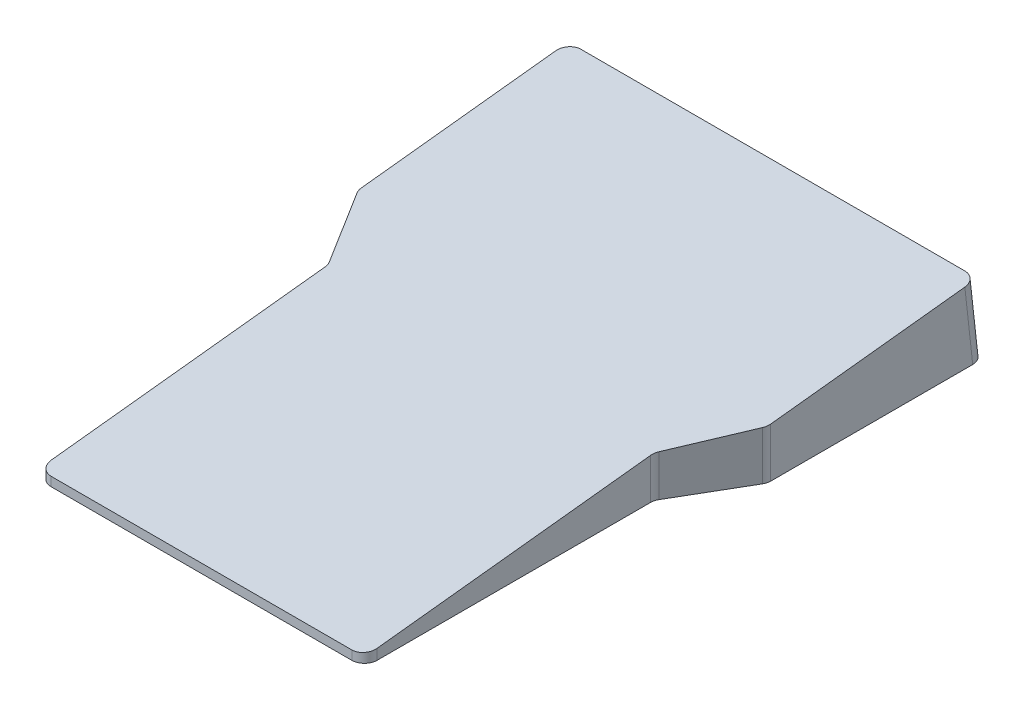
from build123d import *

# Parameters (mm, degrees)
BOSS_EXTRUDE1_DEPTH = 20
SKETCH2_R           = 2.4
SKETCH2_R_2         = 2.35
BOSS_EXTRUDE2_DEPTH = 3
CUT_EXTRUDE1_DEPTH  = 158.718007744
FILLET1_R           = 3.5


with BuildPart() as part:
    # Sketch1 → Boss-Extrude1 (new body)
    with BuildSketch(Plane(origin=(0, 0, 0), x_dir=(1, 0, 0), z_dir=(0, 1, 0))):
        Polygon((-57.597316241, 51.805869074), (-57.597316241, -8.444130926), (-46.097316241, -28.194130926), (-46.097316241, -108.194130926), (43.902683759, -108.194130926), (43.902683759, -28.194130926), (55.402683759, -8.444130926), (55.402683759, 51.805869074), align=None)
    extrude(amount=BOSS_EXTRUDE1_DEPTH)

    # Sketch2 → Boss-Extrude2 (add)
    with BuildSketch(Plane.XZ):
        with Locations(Location((-51.097316241, -45.305869074, 0), (0, 0, 90))):
            Circle(SKETCH2_R)
        with Locations(Location((48.902683759, -45.305869074, 0), (0, 0, 90))):
            Circle(SKETCH2_R)
        with Locations(Location((-31.847316241, -5.130869074, 0), (0, 0, 90))):
            Circle(SKETCH2_R)
        with Locations(Location((-21.847316241, -5.130869074, 0), (0, 0, 90))):
            Circle(SKETCH2_R)
        with Locations(Location((47.402683759, 6.944130926, 0), (0, 0, 90))):
            Circle(SKETCH2_R_2)
        with Locations(Location((-49.597316241, 6.944130926, 0), (0, 0, 90))):
            Circle(SKETCH2_R_2)
    extrude(amount=BOSS_EXTRUDE2_DEPTH)

    # Sketch3 → Cut-Extrude1 (cut, through all)
    with BuildSketch(Plane(origin=(55.402683759, 0, 0), x_dir=(0, 0, -1), z_dir=(1, 0, 0))):
        Polygon((-108.194130926, 20), (-108.194130926, 2.5), (-8.444130926, 13.563542172), (-8.444130926, 20), align=None)
        Polygon((-8.444130926, 20), (-8.444130926, 13.563542172), (49.587615005, 20), align=None)
        Polygon((49.587615005, 20), (51.805869074, 0), (51.805869074, 20), align=None)
    extrude(amount=-CUT_EXTRUDE1_DEPTH, mode=Mode.SUBTRACT)

    # Fillet1
    fillet1_edges = [part.edges().sort_by_distance(p)[0] for p in [
        (-57.597316241, 10, -50.69674204),
        (55.402683759, 10, -50.69674204),
        (-46.097316241, 5.686508139, 28.194130926),
        (-57.597316241, 6.781771086, 8.444130926),
        (43.902683759, 5.686508139, 28.194130926),
        (43.902683759, 1.25, 108.194130926),
        (-46.097316241, 1.25, 108.194130926),
        (55.402683759, 6.781771086, 8.444130926),
    ]]
    fillet(fillet1_edges, radius=FILLET1_R)


solid = part.part
